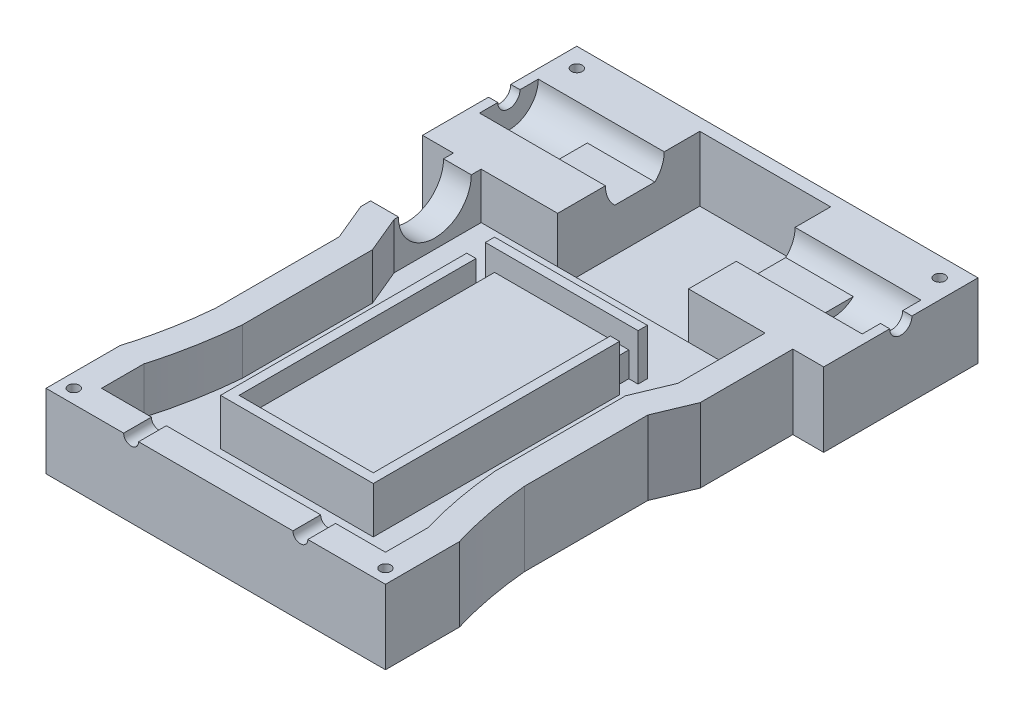
from build123d import *

# Parameters (mm, degrees)
BOSS_EXTRUDE1_DEPTH = 20.32
CUT_EXTRUDE1_DEPTH  = 12.7
SKETCH14_R          = 8.0645
CUT_EXTRUDE4_DEPTH  = 16.002
CUT_EXTRUDE5_DEPTH  = 34.544
SKETCH14_5_R        = 3.048
CUT_EXTRUDE6_DEPTH  = 157.413445344
SKETCH15_W          = 35.898582
SKETCH15_H          = 38.980588406
CUT_EXTRUDE7_DEPTH  = 17.78
SKETCH16_W          = 41.91
SKETCH16_H          = 2.54
BOSS_EXTRUDE2_DEPTH = 12.7
SKETCH16_6_W        = 36.83
SKETCH16_6_H        = 70.104
BOSS_EXTRUDE3_DEPTH = 6.858
SKETCH19_R          = 10
CUT_EXTRUDE12_DEPTH = 11.4
CUT_EXTRUDE17_START = -159.301903077
SKETCH26_R          = 3.5
SKETCH26_R_2        = 1.5
CUT_EXTRUDE17_DEPTH = 177.271903077
SKETCH26_4_R        = 1.5
CUT_EXTRUDE19_DEPTH = 159.301903077
SKETCH29_R          = 1.5
CUT_EXTRUDE20_DEPTH = 159.890064251
SKETCH30_R          = 3.25
CUT_EXTRUDE21_DEPTH = 159.390754219
CUT_EXTRUDE24_DEPTH = 62.674


with BuildPart() as part:
    # Sketch3 → Boss-Extrude1 (new body)
    with BuildSketch(Plane(origin=(0, 0, 0), x_dir=(1, 0, 0), z_dir=(0, 1, 0))):
        with BuildLine():
            Line((101.599873, 0), (110.066582, 0))
            Line((110.066582, 0), (110.066582, 42.333418))
            Line((110.066582, 42.333418), (55.033291, 42.333418))
            Line((55.033291, 42.333418), (8.4666328, 42.333418))
            Line((8.4666328, 42.333418), (0, 42.333418))
            Line((0, 42.333418), (0, 0))
            Line((0, 0), (8.4666328, 0))
            Line((8.4666328, 0), (8.4666328, -25.4))
            Line((8.4666328, -25.4), (12.6999492, -35.56))
            Line((12.6999492, -35.56), (12.6999492, -69.426582))
            add(Edge.make_bspline(
                [(12.6999492, -69.426582), (11.690404189, -80.766544706), (8.46666328, -91.44)],
                knots=[0, 0, 0, 0.504540069, 0.504540069, 0.504540069], degree=2))
            Line((8.46666328, -91.44), (8.46666328, -111.76))
            Line((8.46666328, -111.76), (101.599995682, -111.76))
            Line((101.599995682, -111.76), (101.599995682, -91.44))
            add(Edge.make_bspline(
                [(97.366709, -69.426582), (98.376270675, -80.766537876), (101.599995682, -91.44)],
                knots=[0, 0, 0, 0.504540407, 0.504540407, 0.504540407], degree=2))
            Line((97.366709, -69.426582), (97.366709, -35.56))
            Line((97.366709, -35.56), (101.599873, -25.4))
            Line((101.599873, -25.4), (101.599873, 0))
        make_face()
    extrude(amount=BOSS_EXTRUDE1_DEPTH)

    # Sketch7 → Cut-Extrude1 (cut)
    with BuildSketch(Plane(origin=(0, 20.32, 0), x_dir=(1, 0, 0), z_dir=(0, 1, 0))):
        with BuildLine():
            Line((16.0866328, 0), (93.979873, 0))
            Line((93.979873, 0), (93.979873, -23.876056271))
            Line((93.979873, -23.876056271), (89.746709, -34.036056271))
            Line((89.746709, -34.036056271), (89.746709, -69.759644388))
            add(Edge.make_bspline(
                [(89.746709, -69.759644388), (90.418698914, -77.556217584), (91.829471112, -85.161374913), (93.979995682, -92.545959033)],
                knots=[0, 0, 0, 0, 1, 1, 1, 1], degree=3))
            Line((93.979995682, -92.545959033), (93.979995682, -104.14))
            Line((93.979995682, -104.14), (16.08666328, -104.14))
            Line((16.08666328, -104.14), (16.08666328, -92.545964634))
            add(Edge.make_bspline(
                [(16.08666328, -92.545964634), (18.237198531, -85.161380775), (19.647970427, -77.556219246), (20.3199492, -69.759638641)],
                knots=[0, 0, 0, 0, 1, 1, 1, 1], degree=3))
            Line((20.3199492, -69.759638641), (20.3199492, -34.036005627))
            Line((20.3199492, -34.036005627), (16.0866328, -23.876005627))
            Line((16.0866328, -23.876005627), (16.0866328, 0))
        make_face()
    extrude(amount=-CUT_EXTRUDE1_DEPTH, mode=Mode.SUBTRACT)

    # Sketch14 → Cut-Extrude4 (cut)
    with BuildSketch(Plane.ZY.offset(-2.54)):
        with Locations((-21.166709, 20.32)):
            Circle(SKETCH14_R)
    cut_extrude4 = extrude(amount=-CUT_EXTRUDE4_DEPTH, mode=Mode.SUBTRACT)

    # Sketch14<4> → Cut-Extrude5 (cut)
    with BuildSketch(Plane.ZY.offset(-2.54)):
        with BuildLine():
            Line((-26.672257875, 14.4272), (-15.661160125, 14.4272))
            ThreePointArc((-15.661160125, 14.4272), (-21.166709, 28.3845), (-26.672257875, 14.4272))
        make_face()
    cut_extrude5 = extrude(amount=-CUT_EXTRUDE5_DEPTH, mode=Mode.SUBTRACT)

    # Sketch14<5> → Cut-Extrude6 (cut, through all)
    with BuildSketch(Plane.ZY.offset(-2.54)):
        with Locations((-21.166709, 20.32)):
            Circle(SKETCH14_5_R)
    cut_extrude6 = extrude(amount=CUT_EXTRUDE6_DEPTH, mode=Mode.SUBTRACT)

    # Mirror2: Cut-Extrude4, Cut-Extrude5, Cut-Extrude6 across plane
    add(cut_extrude4.mirror(Plane(origin=(55.033291, 0, 0), x_dir=(0, 0, 1), z_dir=(1, 0, 0))), mode=Mode.SUBTRACT)
    add(cut_extrude5.mirror(Plane(origin=(55.033291, 0, 0), x_dir=(0, 0, 1), z_dir=(1, 0, 0))), mode=Mode.SUBTRACT)
    add(cut_extrude6.mirror(Plane(origin=(55.033291, 0, 0), x_dir=(0, 0, 1), z_dir=(1, 0, 0))), mode=Mode.SUBTRACT)

    # Sketch15 → Cut-Extrude7 (cut)
    with BuildSketch(Plane(origin=(0, 20.32, 0), x_dir=(1, 0, 0), z_dir=(0, 1, 0))):
        with Locations((55.033291, 19.490294203)):
            Rectangle(SKETCH15_W, SKETCH15_H)
    extrude(amount=-CUT_EXTRUDE7_DEPTH, mode=Mode.SUBTRACT)

    # Sketch16 → Boss-Extrude2 (add)
    with BuildSketch(Plane(origin=(0, 7.62, 0), x_dir=(1, 0, 0), z_dir=(0, 1, 0))):
        with Locations((55.0333291, -15.57585033)):
            Rectangle(SKETCH16_W, SKETCH16_H)
        Polygon((75.9883291, -21.92585033), (73.4483291, -21.92585033), (73.4483291, -86.94985033), (36.6183291, -86.94985033), (36.6183291, -21.92585033), (34.0783291, -21.92585033), (34.0783291, -89.48985033), (75.9883291, -89.48985033), align=None)
    extrude(amount=BOSS_EXTRUDE2_DEPTH)

    # Sketch16<6> → Boss-Extrude3 (add)
    with BuildSketch(Plane(origin=(0, 7.62, 0), x_dir=(1, 0, 0), z_dir=(0, 1, 0))):
        with Locations((55.0333291, -51.89785033)):
            Rectangle(SKETCH16_6_W, SKETCH16_6_H)
    extrude(amount=BOSS_EXTRUDE3_DEPTH)

    # Sketch19 → Cut-Extrude12 (cut)
    with BuildSketch(Plane.ZY.offset(-8.4666328)):
        with Locations((12.7, 20.32)):
            Circle(SKETCH19_R)
    extrude(amount=-CUT_EXTRUDE12_DEPTH, mode=Mode.SUBTRACT)


with BuildPart() as body_2:
    # Sketch21 → Loft3 section 0
    with BuildSketch(Plane(origin=(0, 0, 0), x_dir=(-1, 0, 0), z_dir=(0, -1, 0))):
        with BuildLine():
            Line((-8.46666328, -91.44), (-8.46666328, -111.76))
            Line((-8.46666328, -111.76), (-101.599995682, -111.76))
            Line((-101.599995682, -111.76), (-101.599995682, -91.44))
            add(Edge.make_bspline(
                [(-97.366709, -69.426582), (-98.376270675, -80.766537876), (-101.599995682, -91.44)],
                knots=[0, 0, 0, 1, 1, 1], degree=2))
            Line((-97.366709, -69.426582), (-97.366709, -35.56))
            Line((-97.366709, -35.56), (-101.599873, -25.4))
            Line((-101.599873, -25.4), (-101.599873, 0))
            Line((-101.599873, 0), (-110.066582, 0))
            Line((-110.066582, 0), (-110.066582, 42.333418))
            Line((-110.066582, 42.333418), (0, 42.333418))
            Line((0, 42.333418), (0, 0))
            Line((0, 0), (-8.4666328, 0))
            Line((-8.4666328, 0), (-8.4666328, -25.4))
            Line((-8.4666328, -25.4), (-12.6999492, -35.56))
            Line((-12.6999492, -35.56), (-12.6999492, -69.426582))
            add(Edge.make_bspline(
                [(-12.6999492, -69.426582), (-11.690404189, -80.766544706), (-8.46666328, -91.44)],
                knots=[0, 0, 0, 1, 1, 1], degree=2))
        make_face()
    # Sketch20 → Loft3 section 1
    with BuildSketch(Plane(origin=(0, -4.999999906, 0), x_dir=(-1, 0, 0), z_dir=(0, -1, 0))):
        with BuildLine():
            Line((-16.0866328, 7.62), (-7.62, 7.62))
            Line((-7.62, 7.62), (-7.62, 34.713418))
            Line((-7.62, 34.713418), (-102.446582, 34.713418))
            Line((-102.446582, 34.713418), (-102.446582, 7.62))
            Line((-102.446582, 7.62), (-93.979873, 7.62))
            Line((-93.979873, 7.62), (-93.979873, -23.876056271))
            Line((-93.979873, -23.876056271), (-89.746709, -34.036056271))
            Line((-89.746709, -34.036056271), (-89.746709, -69.759644389))
            add(Edge.make_bspline(
                [(-89.746709, -69.759644389), (-90.413284724, -77.493400974), (-91.809170303, -85.091664929), (-93.979995682, -92.545959033)],
                knots=[0, 0, 0, 0, 1, 1, 1, 1], degree=3))
            Line((-93.979995682, -92.545959033), (-93.979995682, -104.14))
            Line((-93.979995682, -104.14), (-16.08666328, -104.14))
            Line((-16.08666328, -104.14), (-16.08666328, -92.545964634))
            add(Edge.make_bspline(
                [(-16.08666328, -92.545964634), (-18.257500019, -85.091668809), (-19.653384668, -77.493400947), (-20.3199492, -69.75963864)],
                knots=[0, 0, 0, 0, 1, 1, 1, 1], degree=3))
            Line((-20.3199492, -69.75963864), (-20.3199492, -34.036005627))
            Line((-20.3199492, -34.036005627), (-16.0866328, -23.876005627))
            Line((-16.0866328, -23.876005627), (-16.0866328, 7.62))
        make_face()
    loft()


with BuildPart() as cut_extrude17_tool:
    # Sketch26 → Cut-Extrude17 (new body)
    with BuildSketch(Plane(origin=(0, -0.999999906, 0), x_dir=(1, 0, 0), z_dir=(0, 1, 0)).offset(CUT_EXTRUDE17_START)):
        with Locations(Location((5.259533714, 37.073884286, 0), (0, 0, 270))):
            Circle(SKETCH26_R)
        with Locations(Location((5.259533714, 37.073884286, 0), (0, 0, 270))):
            Circle(SKETCH26_R_2, mode=Mode.SUBTRACT)
    cut_extrude17 = extrude(amount=CUT_EXTRUDE17_DEPTH)


with BuildPart() as part_1:
    add(part.part)

    # Cut-Extrude17: cut by cut_extrude17_tool
    add(cut_extrude17_tool.part, mode=Mode.SUBTRACT)


with BuildPart() as body_2_1:
    add(body_2.part)

    # Cut-Extrude17: cut by cut_extrude17_tool
    add(cut_extrude17_tool.part, mode=Mode.SUBTRACT)


with BuildPart() as cut_extrude19_tool:
    # Sketch26<4> → Cut-Extrude19 (new, symmetric)
    with BuildSketch(Plane(origin=(0, -0.999999906, 0), x_dir=(1, 0, 0), z_dir=(0, 1, 0))):
        with Locations(Location((5.259533714, 37.073884286, 0), (0, 0, 270))):
            Circle(SKETCH26_4_R)
    cut_extrude19 = extrude(amount=CUT_EXTRUDE19_DEPTH, both=True)


with BuildPart() as part_2:
    add(part_1.part)

    # Cut-Extrude19: cut by cut_extrude19_tool
    add(cut_extrude19_tool.part, mode=Mode.SUBTRACT)


with BuildPart() as body_2_2:
    add(body_2_1.part)

    # Cut-Extrude19: cut by cut_extrude19_tool
    add(cut_extrude19_tool.part, mode=Mode.SUBTRACT)


with BuildPart() as mirror3_tool:
    # Mirror3: Cut-Extrude17, Cut-Extrude19 across plane
    add(cut_extrude17.mirror(Plane(origin=(55.033291, 0, 0), x_dir=(0, 0, 1), z_dir=(1, 0, 0))))
    add(cut_extrude19.mirror(Plane(origin=(55.033291, 0, 0), x_dir=(0, 0, 1), z_dir=(1, 0, 0))))


with BuildPart() as part_3:
    add(part_2.part)

    # Mirror3: cut by mirror3_tool
    add(mirror3_tool.part, mode=Mode.SUBTRACT)


with BuildPart() as body_2_3:
    add(body_2_2.part)

    # Mirror3: cut by mirror3_tool
    add(mirror3_tool.part, mode=Mode.SUBTRACT)


with BuildPart() as cut_extrude20_tool:
    # Sketch29 → Cut-Extrude20 (new, through all)
    with BuildSketch(Plane(origin=(0, 20.32, 0), x_dir=(1, 0, 0), z_dir=(0, 1, 0))):
        with Locations(Location((97.789995682, -107.95, 0), (0, 0, 270))):
            Circle(SKETCH29_R)
        with Locations(Location((12.27666328, -107.95, 0), (0, 0, 270))):
            Circle(SKETCH29_R)
    extrude(amount=-CUT_EXTRUDE20_DEPTH)


with BuildPart() as part_4:
    add(part_3.part)

    # Cut-Extrude20: cut by cut_extrude20_tool
    add(cut_extrude20_tool.part, mode=Mode.SUBTRACT)


with BuildPart() as body_2_4:
    add(body_2_3.part)

    # Cut-Extrude20: cut by cut_extrude20_tool
    add(cut_extrude20_tool.part, mode=Mode.SUBTRACT)


with BuildPart() as cut_extrude21_tool:
    # Sketch30 → Cut-Extrude21 (new, through all)
    with BuildSketch(Plane(origin=(0, 16.970000096, 0), x_dir=(1, 0, 0), z_dir=(0, 1, 0))):
        with Locations(Location((97.789995682, -107.95, 0), (0, 0, 270))):
            Circle(SKETCH30_R)
        with Locations(Location((12.27666328, -107.95, 0), (0, 0, 270))):
            Circle(SKETCH30_R)
    extrude(amount=-CUT_EXTRUDE21_DEPTH)


with BuildPart() as part_5:
    add(part_4.part)

    # Cut-Extrude21: cut by cut_extrude21_tool
    add(cut_extrude21_tool.part, mode=Mode.SUBTRACT)

    # Sketch32 → Cut-Extrude24 (cut)
    with BuildSketch(Plane.XY.offset(111.76)):
        with BuildLine():
            Line((29.766663316, 20.32), (33.866663316, 20.32))
            ThreePointArc((33.866663316, 20.32), (31.816663316, 18.27), (29.766663316, 20.32))
        make_face()
    cut_extrude24 = extrude(amount=-CUT_EXTRUDE24_DEPTH, mode=Mode.SUBTRACT)

    # Mirror8: Cut-Extrude24 across plane
    add(cut_extrude24.mirror(Plane(origin=(55.033291, 0, 0), x_dir=(0, 0, 1), z_dir=(1, 0, 0))), mode=Mode.SUBTRACT)


with BuildPart() as body_2_5:
    add(body_2_4.part)

    # Cut-Extrude21: cut by cut_extrude21_tool
    add(cut_extrude21_tool.part, mode=Mode.SUBTRACT)


solid = Compound([part_5.part, body_2_5.part])
